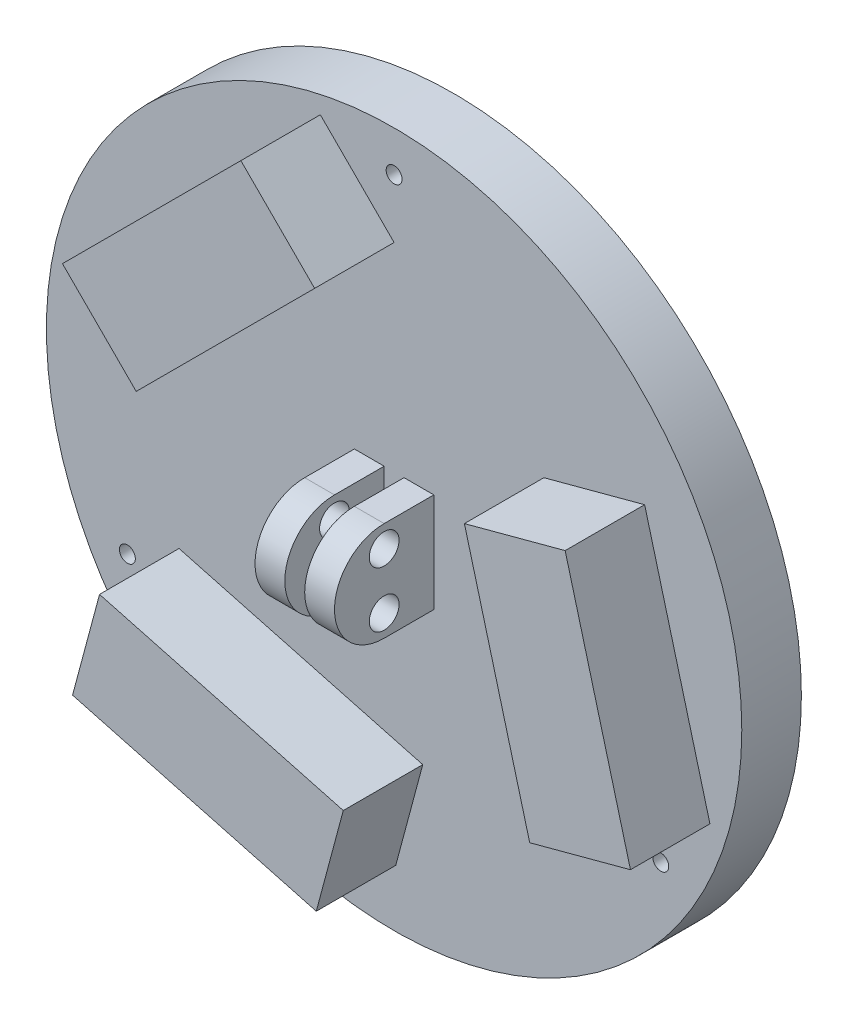
from build123d import *

# Parameters (mm, degrees)
SKETCH2_R           = 35
BOSS_EXTRUDE1_DEPTH = 6
SKETCH3_R           = 0.8
CUT_EXTRUDE1_DEPTH  = 6
SKETCH4_R           = 0.6
CUT_EXTRUDE2_DEPTH  = 6
SKETCH5_W           = 3
SKETCH5_H           = 10
BOSS_EXTRUDE2_DEPTH = 10
CUT_EXTRUDE3_DEPTH  = 55.790510127
SKETCH7_R           = 1.5
CUT_EXTRUDE4_DEPTH  = 55.790510127
BOSS_EXTRUDE3_DEPTH = 8


with BuildPart() as part:
    # Sketch2 → Boss-Extrude1 (new body)
    with BuildSketch(Plane.XY):
        Circle(SKETCH2_R)
    extrude(amount=BOSS_EXTRUDE1_DEPTH)

    # Sketch3 → Cut-Extrude1 (cut)
    with BuildSketch(Plane.XY.offset(6)):
        with Locations((0, 30.914278185)):
            Circle(SKETCH3_R)
        with Locations((26.846787517, -15.585721815)):
            Circle(SKETCH3_R)
        with Locations((-26.846787517, -15.585721815)):
            Circle(SKETCH3_R)
    extrude(amount=-CUT_EXTRUDE1_DEPTH, mode=Mode.SUBTRACT)

    # Sketch4 → Cut-Extrude2 (cut)
    with BuildSketch(Plane.XY.offset(6)):
        Circle(SKETCH4_R)
    extrude(amount=-CUT_EXTRUDE2_DEPTH, mode=Mode.SUBTRACT)

    # Sketch5 → Boss-Extrude2 (add)
    with BuildSketch(Plane.XY.offset(6)):
        with Locations((2.5, 0)):
            Rectangle(SKETCH5_W, SKETCH5_H)
        with Locations((-2.5, 0)):
            Rectangle(SKETCH5_W, SKETCH5_H)
    extrude(amount=BOSS_EXTRUDE2_DEPTH)

    # Sketch6 → Cut-Extrude3 (cut, through all)
    with BuildSketch(Plane(origin=(4, 0, 0), x_dir=(0, 0, -1), z_dir=(1, 0, 0))):
        with BuildLine():
            ThreePointArc((-16, 0), (-14.535533906, 3.535533906), (-11, 5))
            Line((-11, 5), (-16, 5))
            Line((-16, 5), (-16, 0))
        make_face()
        with BuildLine():
            ThreePointArc((-11, -5), (-14.535533906, -3.535533906), (-16, 0))
            Line((-16, 0), (-16, -5))
            Line((-16, -5), (-11, -5))
        make_face()
    extrude(amount=-CUT_EXTRUDE3_DEPTH, mode=Mode.SUBTRACT)

    # Sketch7 → Cut-Extrude4 (cut, through all)
    with BuildSketch(Plane(origin=(4, 0, 0), x_dir=(0, 0, -1), z_dir=(1, 0, 0))):
        with Locations(Location((-11, 2.8, 0), (0, 0, 90))):
            Circle(SKETCH7_R)
        with Locations(Location((-11, -2.8, 0), (0, 0, 90))):
            Circle(SKETCH7_R)
    extrude(amount=-CUT_EXTRUDE4_DEPTH, mode=Mode.SUBTRACT)

    # Sketch8 → Boss-Extrude3 (add)
    with BuildSketch(Plane.XY.offset(6)):
        Polygon((-7.424621202, 32.424621202), (0, 25), (-17.960512242, 7.039487758), (-25.385133445, 14.46410896), align=None)
        Polygon((31.792856271, -9.782400026), (21.650635095, -12.5), (15.076631349, 12.034515988), (25.218852525, 14.752115961), align=None)
        Polygon((-24.368235068, -22.642221176), (-21.650635095, -12.5), (2.883880893, -19.074003746), (0.16628092, -29.216224922), align=None)
    extrude(amount=BOSS_EXTRUDE3_DEPTH)


solid = part.part
